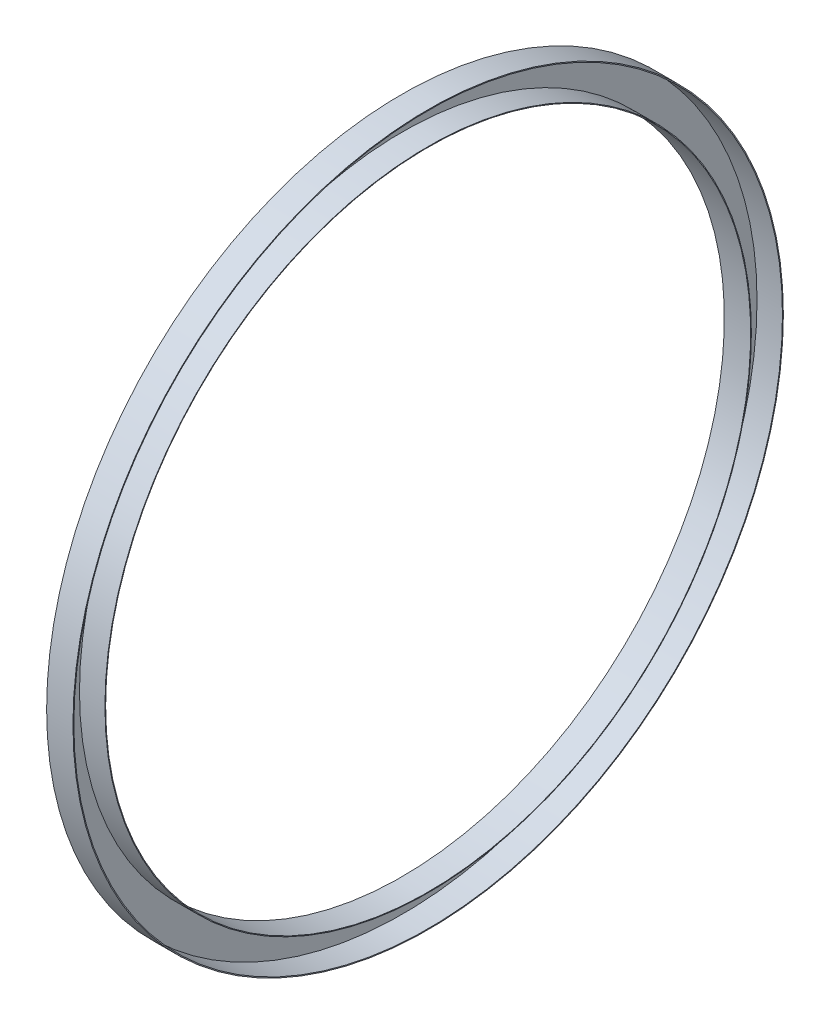
from build123d import *

# Parameters (mm, degrees)
SCALE1_SCALE = 12


with BuildPart() as part:
    # Sketch1 → Revolve1 (revolve)
    with BuildSketch(Plane.XY, mode=Mode.PRIVATE) as revolve1_sk:
        Polygon((0.256064819, 102.578406094), (0.256064819, 93.583973152), (7.62, 93.583973152), (7.62, 93.376118609), (0, 93.376118609), (0, 102.842948239), (7.62, 102.842948239), (7.62, 102.578406094), align=None)
    revolve(revolve1_sk.sketch.rotate(Axis((-297.054464827, 0, 0), (1, 0, 0)), 90), axis=Axis((-297.054464827, 0, 0), (1, 0, 0)))


with BuildPart() as part_1:
    # Scale1: scaled about (2.378428564, 0, 0)
    add(part.part.scale(SCALE1_SCALE).moved(Location((-26.162714204, 0, 0))))


solid = part_1.part
